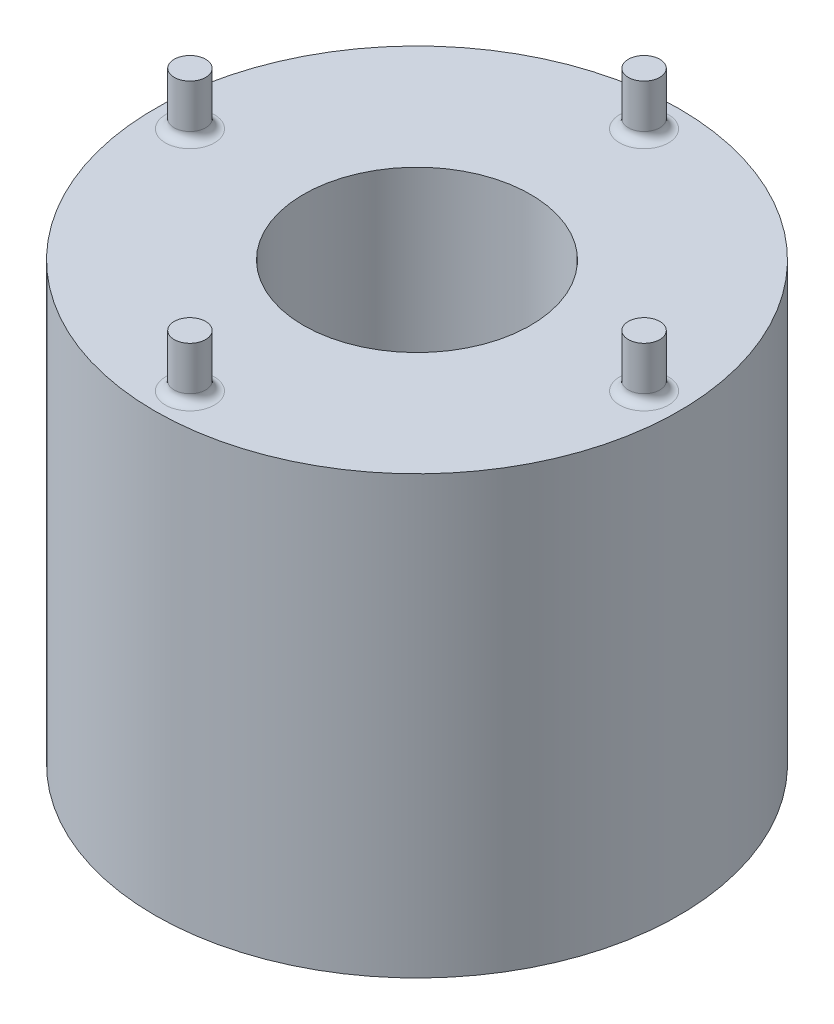
from build123d import *

# Parameters (mm, degrees)
SKETCH1_R                = 15
BOSS_EXTRUDE1_DEPTH      = 10
SKETCH2_R                = 15
BOSS_EXTRUDE2_DEPTH      = 15
SKETCH3_R                = 0.9
BOSS_EXTRUDE3_DEPTH      = 3
FILLET1_R                = 0.5
CIRPATTERN1_COUNT        = 4
FILLET1_OF_CIRPATTERN1_R = 0.5
SKETCH5_R                = 6.5
CUT_EXTRUDE1_DEPTH       = 10
SKETCH6_R                = 1.75
CUT_EXTRUDE2_DEPTH       = 10


with BuildPart() as part:
    # Sketch1 → Boss-Extrude1 (new body)
    with BuildSketch(Plane(origin=(0, 0, 0), x_dir=(1, 0, 0), z_dir=(0, 1, 0))):
        with Locations(Location((0, 0, 0), (0, 0, 270))):
            Circle(SKETCH1_R)
    extrude(amount=BOSS_EXTRUDE1_DEPTH)

    # Sketch2 → Boss-Extrude2 (add)
    with BuildSketch(Plane(origin=(0, 10, 0), x_dir=(1, 0, 0), z_dir=(0, 1, 0))):
        with Locations(Location((0, 0, 0), (0, 0, 270))):
            Circle(SKETCH2_R)
    extrude(amount=BOSS_EXTRUDE2_DEPTH)

    # Sketch3 → Boss-Extrude3 (add)
    with BuildSketch(Plane(origin=(0, 25, 0), x_dir=(1, 0, 0), z_dir=(0, 1, 0))):
        with Locations(Location((0, -13, 0), (0, 0, 270))):
            Circle(SKETCH3_R)
    boss_extrude3 = extrude(amount=BOSS_EXTRUDE3_DEPTH)

    # Fillet1
    fillet1_edges = [part.edges().sort_by_distance(p)[0] for p in [
        (0, 25, 12.1),
    ]]
    fillet(fillet1_edges, radius=FILLET1_R)

    # CirPattern1: Boss-Extrude3 ×4 about axis
    cirpattern1_axis = Axis((0, 0, 0), (0, 1, 0))
    for i in range(1, CIRPATTERN1_COUNT):
        add(boss_extrude3.rotate(cirpattern1_axis, i * 360 / CIRPATTERN1_COUNT))

    # Fillet1 of CirPattern1
    fillet1_of_cirpattern1_edges = [part.edges().sort_by_distance(p)[0] for p in [
        (12.1, 25, 0),
        (0, 25, -12.1),
        (-12.1, 25, 0),
    ]]
    fillet(fillet1_of_cirpattern1_edges, radius=FILLET1_OF_CIRPATTERN1_R)

    # Sketch5 → Cut-Extrude1 (cut)
    with BuildSketch(Plane(origin=(0, 25, 0), x_dir=(1, 0, 0), z_dir=(0, 1, 0))):
        with Locations(Location((0, 0, 0), (0, 0, 270))):
            Circle(SKETCH5_R)
    extrude(amount=-CUT_EXTRUDE1_DEPTH, mode=Mode.SUBTRACT)

    # Sketch6 → Cut-Extrude2 (cut)
    with BuildSketch(Plane(origin=(0, 15, 0), x_dir=(1, 0, 0), z_dir=(0, 1, 0))):
        with Locations(Location((0, 0, 0), (0, 0, 270))):
            Circle(SKETCH6_R)
    extrude(amount=-CUT_EXTRUDE2_DEPTH, mode=Mode.SUBTRACT)


solid = part.part
